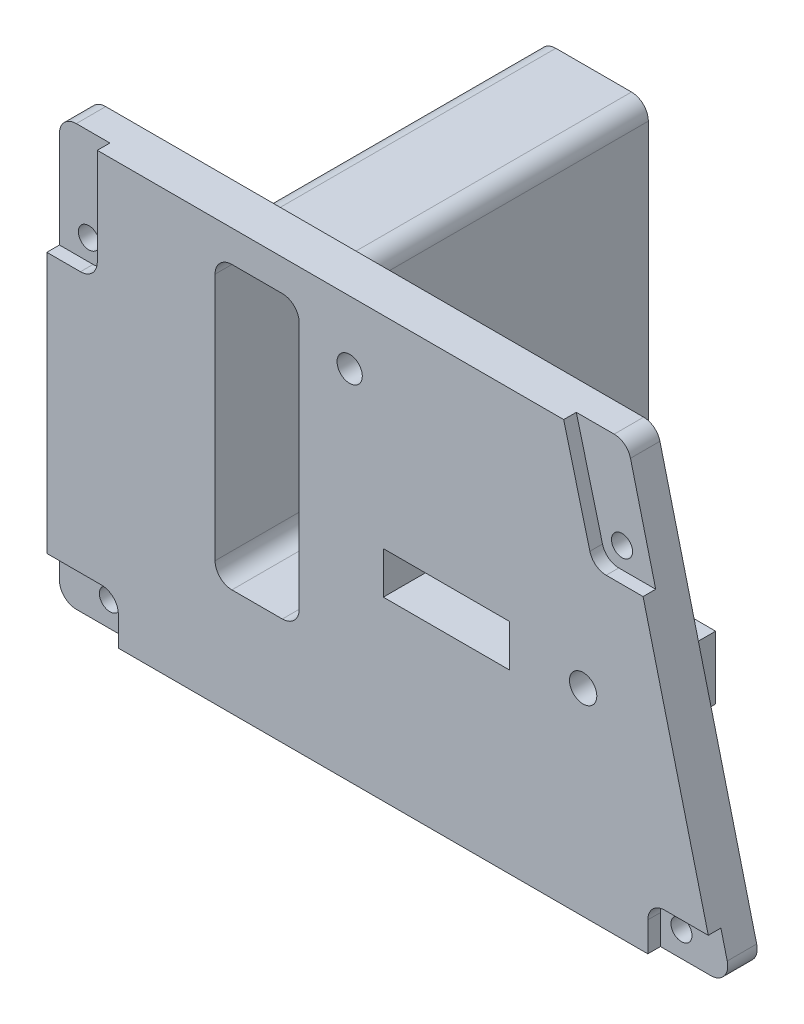
from build123d import *

# Parameters (mm, degrees)
BOSS_EXTRUDE1_DEPTH = 10
SKETCH2_R           = 3
SKETCH2_W           = 20
SKETCH2_H           = 67
SKETCH2_W_2         = 30
SKETCH2_H_2         = 10
CUT_EXTRUDE1_DEPTH  = 10
FILLET1_R           = 4
BOSS_EXTRUDE2_START = 70
BOSS_EXTRUDE2_DEPTH = 70
CUT_EXTRUDE5_DEPTH  = 3
SKETCH7_R           = 2.5
CUT_EXTRUDE6_DEPTH  = 7
CUT_EXTRUDE8_START  = -5
SKETCH8_R           = 3.5
CUT_EXTRUDE8_DEPTH  = 30
SKETCH9_W           = 4
SKETCH9_H           = 15
BOSS_EXTRUDE3_DEPTH = 10
SKETCH10_W          = 4
SKETCH10_H          = 15
BOSS_EXTRUDE4_DEPTH = 16.5
SKETCH5_R           = 3.25
CUT_EXTRUDE10_DEPTH = 20


with BuildPart() as part:
    # Sketch1 → Boss-Extrude1 (new body)
    with BuildSketch(Plane.XY):
        with BuildLine():
            Line((-38.056074766, 50.23364486), (89.820819608, 50.23364486))
            ThreePointArc((89.820819608, 50.23364486), (92.282468446, 49.386466612), (93.701389609, 47.20378736))
            Line((93.701389609, 47.20378736), (116.701389609, -44.79621264))
            ThreePointArc((116.701389609, -44.79621264), (115.97364136, -48.228003978), (112.820819608, -49.76635514))
            Line((112.820819608, -49.76635514), (-38.056074766, -49.76635514))
            ThreePointArc((-38.056074766, -49.76635514), (-40.884501891, -48.594782265), (-42.056074766, -45.76635514))
            Line((-42.056074766, -45.76635514), (-42.056074766, 46.23364486))
            ThreePointArc((-42.056074766, 46.23364486), (-40.884501891, 49.062071985), (-38.056074766, 50.23364486))
        make_face()
    extrude(amount=BOSS_EXTRUDE1_DEPTH)

    # Sketch2 → Cut-Extrude1 (cut)
    with BuildSketch(Plane.XY.offset(10)):
        with Locations((29.943925234, 35.23364486)):
            Circle(SKETCH2_R)
        with Locations((7.943925234, 9.23364486)):
            Rectangle(SKETCH2_W, SKETCH2_H)
        with Locations((52.943925234, -2.76635514)):
            Rectangle(SKETCH2_W_2, SKETCH2_H_2)
    extrude(amount=-CUT_EXTRUDE1_DEPTH, mode=Mode.SUBTRACT)

    # Fillet1
    fillet1_edges = [part.edges().sort_by_distance(p)[0] for p in [
        (-2.056074766, -24.26635514, 5),
        (-2.056074766, 42.73364486, 5),
        (17.943925234, 42.73364486, 5),
        (17.943925234, -24.26635514, 5),
    ]]
    fillet(fillet1_edges, radius=FILLET1_R)

    # Sketch4 → Boss-Extrude2 (add)
    with BuildSketch(Plane(origin=(0, 0, 0), x_dir=(-1, 0, 0), z_dir=(0, 0, -1)).offset(BOSS_EXTRUDE2_START)):
        with BuildLine():
            Line((-16.943925234, 45.73364486), (1.056074766, 45.73364486))
            ThreePointArc((1.056074766, 45.73364486), (3.884501891, 44.562071985), (5.056074766, 41.73364486))
            Line((5.056074766, 41.73364486), (5.056074766, -23.26635514))
            ThreePointArc((5.056074766, -23.26635514), (3.884501891, -26.094782265), (1.056074766, -27.26635514))
            Line((1.056074766, -27.26635514), (-16.943925234, -27.26635514))
            ThreePointArc((-16.943925234, -27.26635514), (-19.772352358, -26.094782265), (-20.943925234, -23.26635514))
            Line((-20.943925234, -23.26635514), (-20.943925234, 41.73364486))
            ThreePointArc((-20.943925234, 41.73364486), (-19.772352358, 44.562071985), (-16.943925234, 45.73364486))
        make_face()
        with BuildLine():
            Line((-1.943925234, -24.26635514), (-13.943925234, -24.26635514))
            ThreePointArc((-13.943925234, -24.26635514), (-16.772352358, -23.094782265), (-17.943925234, -20.26635514))
            Line((-17.943925234, -20.26635514), (-17.943925234, 38.73364486))
            ThreePointArc((-17.943925234, 38.73364486), (-16.772352358, 41.562071985), (-13.943925234, 42.73364486))
            Line((-13.943925234, 42.73364486), (-1.943925234, 42.73364486))
            ThreePointArc((-1.943925234, 42.73364486), (0.884501891, 41.562071985), (2.056074766, 38.73364486))
            Line((2.056074766, 38.73364486), (2.056074766, -20.26635514))
            ThreePointArc((2.056074766, -20.26635514), (0.884501891, -23.094782265), (-1.943925234, -24.26635514))
        make_face(mode=Mode.SUBTRACT)
    extrude(amount=-BOSS_EXTRUDE2_DEPTH)

    # Sketch6 → Cut-Extrude5 (cut)
    with BuildSketch(Plane.XY.offset(10)):
        with BuildLine():
            Line((-42.056074766, 50.23364486), (-30.056074766, 50.23364486))
            Line((-30.056074766, 50.23364486), (-30.056074766, 27.23364486))
            ThreePointArc((-30.056074766, 27.23364486), (-31.227647642, 24.405217735), (-34.056074766, 23.23364486))
            Line((-34.056074766, 23.23364486), (-42.056074766, 23.23364486))
            Line((-42.056074766, 23.23364486), (-42.056074766, 50.23364486))
        make_face()
        with BuildLine():
            Line((-25.056074766, -49.76635514), (-42.056074766, -49.76635514))
            Line((-42.056074766, -49.76635514), (-42.056074766, -38.76635514))
            Line((-42.056074766, -38.76635514), (-29.056074766, -38.76635514))
            ThreePointArc((-29.056074766, -38.76635514), (-26.227647642, -39.937928015), (-25.056074766, -42.76635514))
            Line((-25.056074766, -42.76635514), (-25.056074766, -49.76635514))
        make_face()
        with BuildLine():
            Line((80.820819608, 50.23364486), (87.044039625, 26.229796225))
            ThreePointArc((87.044039625, 26.229796225), (88.468109177, 24.070150388), (90.916027217, 23.23364486))
            Line((90.916027217, 23.23364486), (99.820819608, 23.23364486))
            Line((99.820819608, 23.23364486), (99.820819608, 50.23364486))
            Line((99.820819608, 50.23364486), (80.820819608, 50.23364486))
        make_face()
        with BuildLine():
            Line((100.820819608, -49.76635514), (116.820819608, -49.76635514))
            Line((116.820819608, -49.76635514), (116.820819608, -38.76635514))
            Line((116.820819608, -38.76635514), (104.820819608, -38.76635514))
            ThreePointArc((104.820819608, -38.76635514), (101.992392483, -39.937928015), (100.820819608, -42.76635514))
            Line((100.820819608, -42.76635514), (100.820819608, -49.76635514))
        make_face()
    extrude(amount=-CUT_EXTRUDE5_DEPTH, mode=Mode.SUBTRACT)

    # Sketch7 → Cut-Extrude6 (cut)
    with BuildSketch(Plane.XY.offset(7)):
        with Locations((91.68982912, 28.23364486)):
            Circle(SKETCH7_R)
        with Locations((-35.056074766, 28.23364486)):
            Circle(SKETCH7_R)
        with Locations((105.820819608, -43.76635514)):
            Circle(SKETCH7_R)
        with Locations((-30.056074766, -43.76635514)):
            Circle(SKETCH7_R)
    extrude(amount=-CUT_EXTRUDE6_DEPTH, mode=Mode.SUBTRACT)

    # Sketch8 → Cut-Extrude8 (cut)
    with BuildSketch(Plane(origin=(-1.056074766, 45.73364486, -70), x_dir=(0, 0, -1), z_dir=(1, 0, 0)).offset(CUT_EXTRUDE8_START)):
        with Locations(Location((-55, -36.5, 0), (0, 0, 270))):
            Circle(SKETCH8_R)
    extrude(amount=CUT_EXTRUDE8_DEPTH, mode=Mode.SUBTRACT)

    # Sketch9 → Boss-Extrude3 (add)
    with BuildSketch(Plane(origin=(0, 0, 0), x_dir=(-1, 0, 0), z_dir=(0, 0, -1))):
        with Locations((-94.943925234, -2.76635514)):
            Rectangle(SKETCH9_W, SKETCH9_H)
    extrude(amount=BOSS_EXTRUDE3_DEPTH)

    # Sketch10 → Boss-Extrude4 (add)
    with BuildSketch(Plane.ZY.offset(-92.943925234)):
        with Locations((-8, -2.76635514)):
            Rectangle(SKETCH10_W, SKETCH10_H)
    extrude(amount=BOSS_EXTRUDE4_DEPTH)

    # Sketch5 → Cut-Extrude10 (cut)
    with BuildSketch(Plane.XY.offset(10)):
        with Locations((85.443925234, -2.76635514)):
            Circle(SKETCH5_R)
    extrude(amount=-CUT_EXTRUDE10_DEPTH, mode=Mode.SUBTRACT)


solid = part.part
